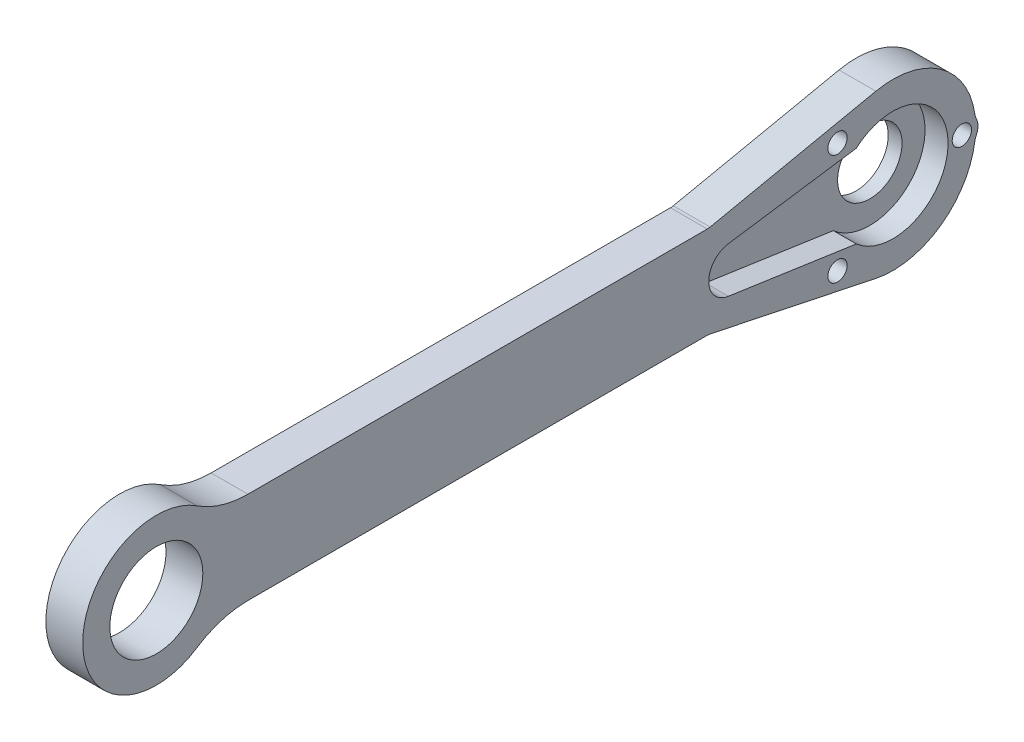
from build123d import *

# Parameters (mm, degrees)
BOSS_EXTRU_1_DEPTH      = 4
ESQUISSE2_R             = 5.05
ESQUISSE2_R_2           = 3.5
ENL_V_MAT_EXTRU_1_DEPTH = 10
ENL_V_MAT_EXTRU_2_DEPTH = 2.5
ESQUISSE5_R             = 1.05
ENL_V_MAT_EXTRU_3_DEPTH = 51.225118218
CONG_2_R                = 1.5
CONG_3_R                = 10


with BuildPart() as part:
    # Esquisse1 → Boss.-Extru.1 (new body)
    with BuildSketch(Plane(origin=(0, 0, 0), x_dir=(0, 0, -1), z_dir=(1, 0, 0))):
        with BuildLine():
            Line((-33.755002002, 5), (20, 5))
            Line((20, 5), (38.152060387, 8.808241549))
            ThreePointArc((38.152060387, 8.808241549), (45.281301679, 7.28751347), (48.945833333, 0.985934061))
            ThreePointArc((48.945833333, 0.985934061), (49.25, 0), (48.945833333, -0.985934061))
            ThreePointArc((48.945833333, -0.985934061), (45.281301679, -7.28751347), (38.152060387, -8.808241549))
            Line((38.152060387, -8.808241549), (20, -5))
            Line((20, -5), (-33.755002002, -5))
            ThreePointArc((-33.755002002, -5), (-48, 0), (-33.755002002, 5))
        make_face()
    extrude(amount=BOSS_EXTRU_1_DEPTH)

    # Esquisse2 → Enlèv. mat.-Extru.1 (cut)
    with BuildSketch(Plane(origin=(4, 0, 0), x_dir=(0, 0, -1), z_dir=(1, 0, 0))):
        with Locations((-40, 0)):
            Circle(ESQUISSE2_R)
        with Locations((40, 0)):
            Circle(ESQUISSE2_R_2)
    extrude(amount=-ENL_V_MAT_EXTRU_1_DEPTH, mode=Mode.SUBTRACT)

    # Esquisse3 → Enlèv. mat.-Extru.2 (cut)
    with BuildSketch(Plane(origin=(4, 0, 0), x_dir=(0, 0, -1), z_dir=(1, 0, 0))):
        with BuildLine():
            Line((22.139192589, 2.473826593), (36.031373033, 4.5))
            ThreePointArc((36.031373033, 4.5), (46, 0), (36.031373033, -4.5))
            Line((36.031373033, -4.5), (22.139192589, -2.473826593))
            ThreePointArc((22.139192589, -2.473826593), (20, 0), (22.139192589, 2.473826593))
        make_face()
    extrude(amount=-ENL_V_MAT_EXTRU_2_DEPTH, mode=Mode.SUBTRACT)

    # Esquisse5 → Enlèv. mat.-Extru.3 (cut, through all)
    with BuildSketch(Plane(origin=(4, 0, 0), x_dir=(0, 0, -1), z_dir=(1, 0, 0))):
        with Locations((33.98959236, 6.01040764)):
            Circle(ESQUISSE5_R)
        with Locations(Location((33.98959236, -6.01040764, 0), (0, 0, 180))):
            Circle(ESQUISSE5_R)
        with Locations((47.5, 0)):
            Circle(ESQUISSE5_R)
    extrude(amount=-ENL_V_MAT_EXTRU_3_DEPTH, mode=Mode.SUBTRACT)

    # Congé2
    cong_2_edges = [part.edges().sort_by_distance(p)[0] for p in [
        (2, -0.985934061, -48.945833333),
        (2, -5, -20),
        (2, 5, -20),
        (2, 0.985934061, -48.945833333),
    ]]
    fillet(cong_2_edges, radius=CONG_2_R)

    # Congé3
    cong_3_edges = [part.edges().sort_by_distance(p)[0] for p in [
        (2, -5, 33.755002002),
        (2, 5, 33.755002002),
    ]]
    fillet(cong_3_edges, radius=CONG_3_R)


solid = part.part
